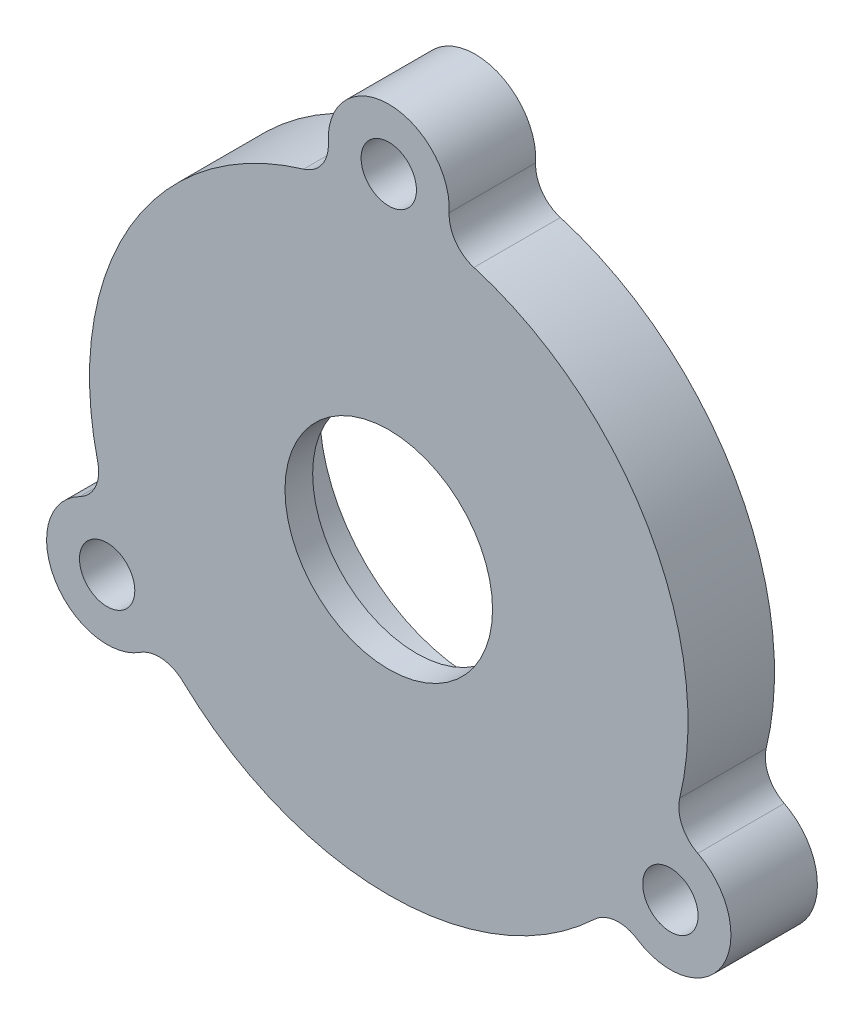
from build123d import *

# Parameters (mm, degrees)
SKETCH_1_R          = 6
SKETCH_1_R_2        = 1.6
EXTRUDE_1_DEPTH     = 5
FILLET_1_R          = 2
SKETCH_3_R          = 15.8
SKETCH_3_R_2        = 11.7
CUT_EXTRUDE_1_DEPTH = 2.5
SKETCH_4_R          = 9
CUT_EXTRUDE_2_DEPTH = 3.4


with BuildPart() as part:
    # ｽｹｯﾁ1 → ﾎﾞｽ - 押し出し1 (new body)
    with BuildSketch(Plane.XY):
        with BuildLine():
            ThreePointArc((-3.021819699, 17.034042553), (-14.982239485, 8.65), (-16.26282343, -5.900048651))
            ThreePointArc((-16.26282343, -5.900048651), (-19.312366504, -11.15), (-13.24100373, -11.133993902))
            ThreePointArc((-13.24100373, -11.133993902), (0, -17.3), (13.24100373, -11.133993902))
            ThreePointArc((13.24100373, -11.133993902), (19.312366504, -11.15), (16.26282343, -5.900048651))
            ThreePointArc((16.26282343, -5.900048651), (14.982239485, 8.65), (3.021819699, 17.034042553))
            ThreePointArc((3.021819699, 17.034042553), (0, 22.3), (-3.021819699, 17.034042553))
        make_face()
        Circle(SKETCH_1_R, mode=Mode.SUBTRACT)
        with Locations((0, 18.8)):
            Circle(SKETCH_1_R_2, mode=Mode.SUBTRACT)
        with Locations((16.281277591, -9.4)):
            Circle(SKETCH_1_R_2, mode=Mode.SUBTRACT)
        with Locations((-16.281277591, -9.4)):
            Circle(SKETCH_1_R_2, mode=Mode.SUBTRACT)
    extrude(amount=EXTRUDE_1_DEPTH)

    # ﾌｨﾚｯﾄ1
    fillet_1_edges = [part.edges().sort_by_distance(p)[0] for p in [
        (16.26282343, -5.900048651, 2.5),
        (13.24100373, -11.133993902, 2.5),
        (-13.24100373, -11.133993902, 2.5),
        (-16.26282343, -5.900048651, 2.5),
        (-3.021819699, 17.034042553, 2.5),
        (3.021819699, 17.034042553, 2.5),
    ]]
    fillet(fillet_1_edges, radius=FILLET_1_R)

    # ｽｹｯﾁ3 → ｶｯﾄ - 押し出し1 (cut)
    with BuildSketch(Plane(origin=(0, 0, 0), x_dir=(-1, 0, 0), z_dir=(0, 0, -1))):
        Circle(SKETCH_3_R)
        Circle(SKETCH_3_R_2, mode=Mode.SUBTRACT)
    extrude(amount=-CUT_EXTRUDE_1_DEPTH, mode=Mode.SUBTRACT)

    # ｽｹｯﾁ4 → ｶｯﾄ - 押し出し2 (cut)
    with BuildSketch(Plane(origin=(0, 0, 0), x_dir=(-1, 0, 0), z_dir=(0, 0, -1))):
        Circle(SKETCH_4_R)
    extrude(amount=-CUT_EXTRUDE_2_DEPTH, mode=Mode.SUBTRACT)


solid = part.part
